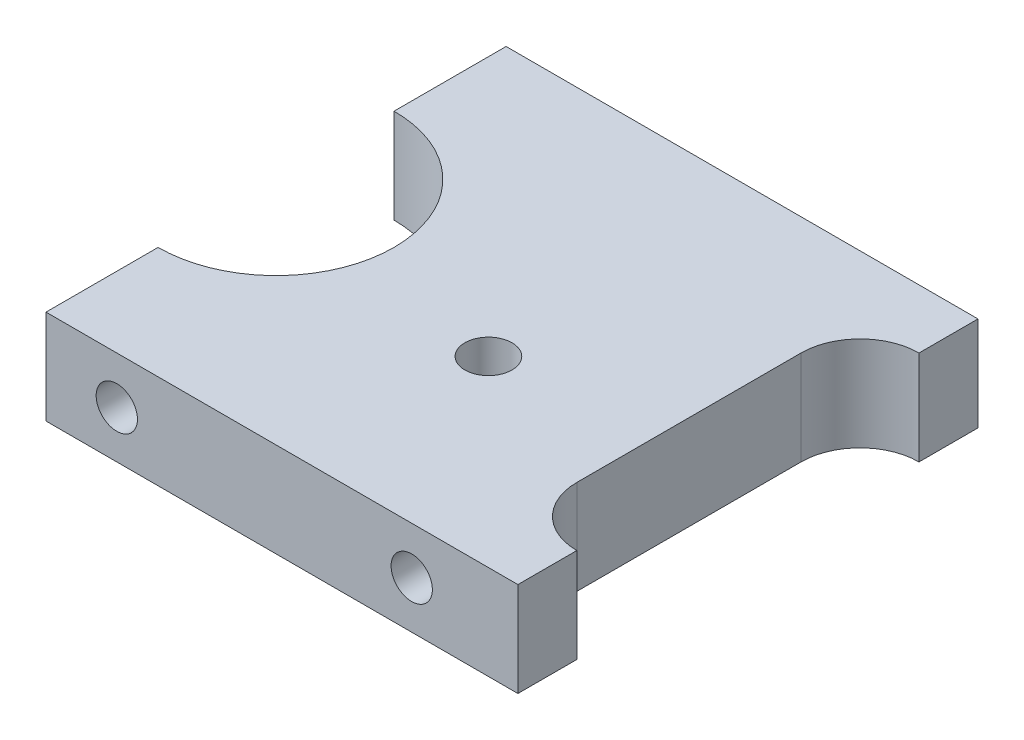
from build123d import *

# Parameters (mm, degrees)
SKETCH_1_W          = 40
SKETCH_1_H          = 39
SKETCH_1_R          = 2
EXTRUDE_1_DEPTH     = 8
SKETCH_2_R          = 1.75
CUT_EXTRUDE_1_DEPTH = 8
CUT_EXTRUDE_START   = -31
SKETCH_2_3_R        = 1.75
CUT_EXTRUDE_2_DEPTH = 8
SKETCH_4_R          = 10
CUT_EXTRUDE_3_DEPTH = 10
CUT_EXTRUDE_5_DEPTH = 10


with BuildPart() as part:
    # 草图1 → 凸台-拉伸1 (new body)
    with BuildSketch(Plane(origin=(0, 0, 0), x_dir=(1, 0, 0), z_dir=(0, 1, 0))):
        with Locations((-2, 4)):
            Rectangle(SKETCH_1_W, SKETCH_1_H)
        with Locations(Location((0, 0, 0), (0, 0, 270))):
            Circle(SKETCH_1_R, mode=Mode.SUBTRACT)
    extrude(amount=EXTRUDE_1_DEPTH)

    # 草图2 → 切除-拉伸1 (cut)
    with BuildSketch(Plane.XY.offset(15.5)):
        with Locations((9, 4)):
            Circle(SKETCH_2_R)
        with Locations((-16, 4)):
            Circle(SKETCH_2_R)
    extrude(amount=-CUT_EXTRUDE_1_DEPTH, mode=Mode.SUBTRACT)

    # 草图2<3> → 切除-拉伸2 (cut)
    with BuildSketch(Plane.XY.offset(15.5).offset(CUT_EXTRUDE_START)):
        with Locations((9, 4)):
            Circle(SKETCH_2_3_R)
        with Locations((-16, 4)):
            Circle(SKETCH_2_3_R)
    extrude(amount=-CUT_EXTRUDE_2_DEPTH, mode=Mode.SUBTRACT)

    # 草图4 → 切除-拉伸3 (cut)
    with BuildSketch(Plane(origin=(0, 0, 0), x_dir=(-1, 0, 0), z_dir=(0, -1, 0))):
        with Locations((22, 4)):
            Circle(SKETCH_4_R)
    extrude(amount=-CUT_EXTRUDE_3_DEPTH, mode=Mode.SUBTRACT)

    # 草图6 → 切除-拉伸5 (cut)
    with BuildSketch(Plane(origin=(0, 8, 0), x_dir=(1, 0, 0), z_dir=(0, 1, 0))):
        with BuildLine():
            Line((13, -5.5), (13, 13.5))
            ThreePointArc((13, 13.5), (18, 18.5), (23, 13.5))
            Line((23, 13.5), (23, -5.5))
            ThreePointArc((23, -5.5), (18, -10.5), (13, -5.5))
        make_face()
    extrude(amount=-CUT_EXTRUDE_5_DEPTH, mode=Mode.SUBTRACT)


solid = part.part
